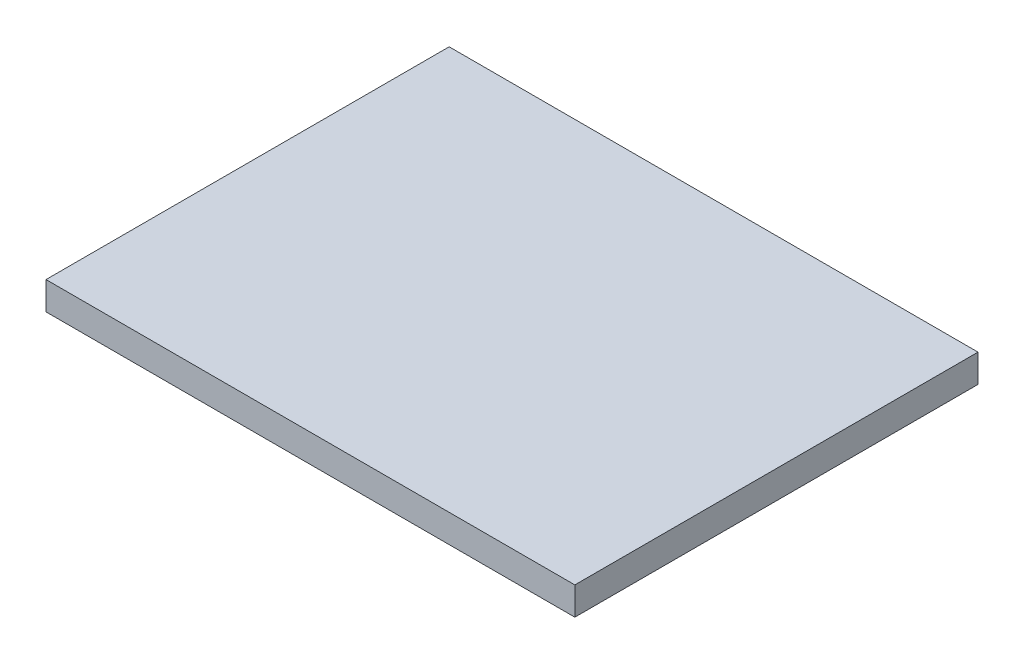
from build123d import *

# Parameters (mm, degrees)
SKETCH1_W           = 47.982254287
SKETCH1_H           = 36.579064224
BOSS_EXTRUDE1_DEPTH = 2.54


with BuildPart() as part:
    # Sketch1 → Boss-Extrude1 (new body)
    with BuildSketch(Plane(origin=(0, 0, 0), x_dir=(1, 0, 0), z_dir=(0, 1, 0))):
        with Locations((1.406887085, 1.036653642)):
            Rectangle(SKETCH1_W, SKETCH1_H)
    extrude(amount=BOSS_EXTRUDE1_DEPTH)


solid = part.part
